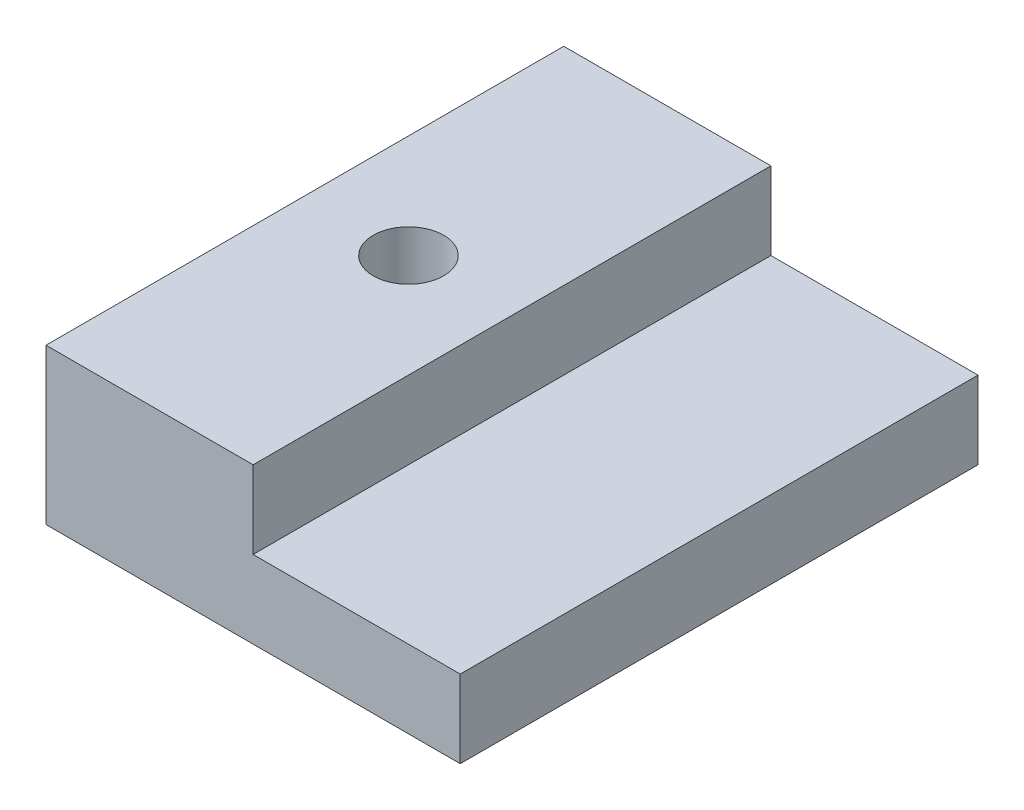
from build123d import *

# Parameters (mm, degrees)
SKETCH1_W              = 20
SKETCH1_H              = 50
BOSS_EXTRUDE1_DEPTH    = 15
SKETCH3_W              = 20
SKETCH3_H              = 50
BOSS_EXTRUDE2_DEPTH    = 7.5
M8X1_25_TAPPED_HOLE1_D = 6.8


with BuildPart() as part:
    # Sketch1 → Boss-Extrude1 (new body)
    with BuildSketch(Plane(origin=(0, 0, 0), x_dir=(1, 0, 0), z_dir=(0, 1, 0))):
        with Locations((10, 25)):
            Rectangle(SKETCH1_W, SKETCH1_H)
    extrude(amount=BOSS_EXTRUDE1_DEPTH)

    # Sketch3 → Boss-Extrude2 (add)
    with BuildSketch(Plane(origin=(0, 0, 0), x_dir=(-1, 0, 0), z_dir=(0, -1, 0))):
        with Locations((-30, 25)):
            Rectangle(SKETCH3_W, SKETCH3_H)
    extrude(amount=-BOSS_EXTRUDE2_DEPTH)

    # M8x1.25 Tapped Hole1 (through all)
    with Locations(Plane(origin=(0, 15, 0), x_dir=(1, 0, 0), z_dir=(0, 1, 0))):
        with Locations((10, 25)):
            Hole(M8X1_25_TAPPED_HOLE1_D / 2)


solid = part.part
